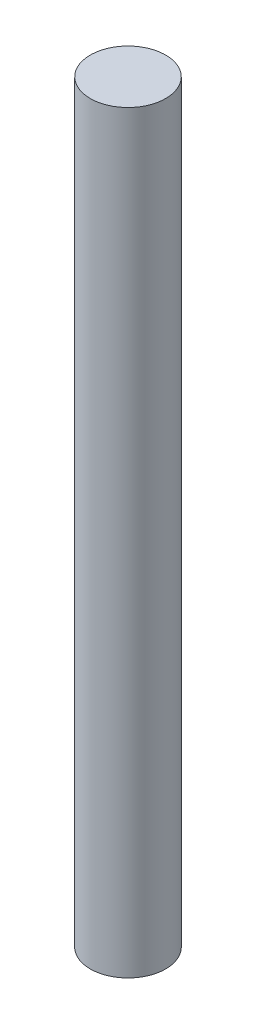
from build123d import *

# Parameters (mm, degrees)
SKETCH1_R           = 1
BOSS_EXTRUDE1_DEPTH = 20


with BuildPart() as part:
    # Sketch1 → Boss-Extrude1 (new body)
    with BuildSketch(Plane(origin=(0, 0, 0), x_dir=(1, 0, 0), z_dir=(0, 1, 0))):
        with Locations(Location((-35.958943192, 8.923145162, 0), (0, 0, 270))):
            Circle(SKETCH1_R)
    extrude(amount=BOSS_EXTRUDE1_DEPTH)


solid = part.part
